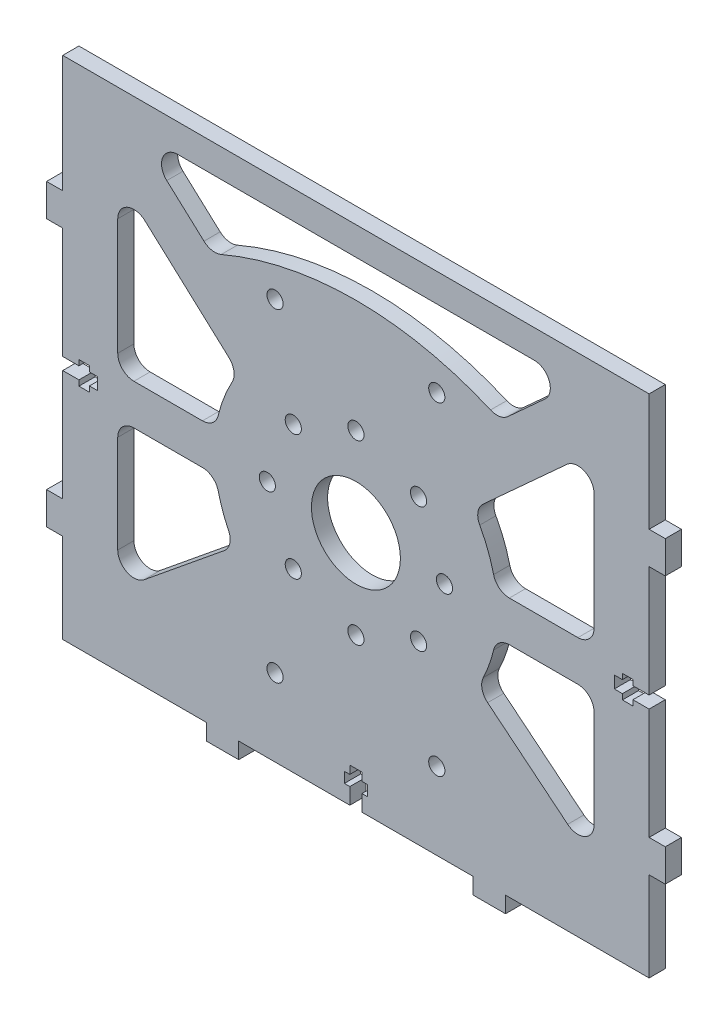
from build123d import *

# Parameters (mm, degrees)
SKETCH_1_R          = 2
SKETCH_1_R_2        = 11
EXTRUDE_1_DEPTH     = 4
CUT_EXTRUDE_2_DEPTH = 4


with BuildPart() as part:
    # 草图1 → 凸台-拉伸1 (new body)
    with BuildSketch(Plane.XY):
        Polygon((149, 64.5), (145, 64.5), (145, 37), (141, 37), (141, 29), (145, 29), (145, 6.9), (151.5, 6.9), (180.5, 6.9), (180.5, 2.9), (188.5, 2.9), (188.5, 6.9), (216, 6.9), (216, 10.9), (214.65, 10.9), (214.65, 13.5), (216, 13.5), (216, 15.5), (219, 15.5), (219, 13.5), (220.35, 13.5), (220.35, 10.9), (219, 10.9), (219, 6.9), (246.5, 6.9), (246.5, 2.9), (254.5, 2.9), (254.5, 6.9), (283.5, 6.9), (290, 6.9), (290, 29), (294, 29), (294, 37), (290, 37), (290, 64.5), (286, 64.5), (286, 63.15), (283.4, 63.15), (283.4, 64.5), (281.4, 64.5), (281.4, 67.5), (283.4, 67.5), (283.4, 68.85), (286, 68.85), (286, 67.5), (290, 67.5), (290, 95), (294, 95), (294, 103), (290, 103), (290, 132), (145, 132), (145, 103), (141, 103), (141, 95), (145, 95), (145, 67.5), (149, 67.5), (149, 68.85), (151.6, 68.85), (151.6, 67.5), (153.6, 67.5), (153.6, 64.5), (151.6, 64.5), (151.6, 63.15), (149, 63.15), align=None)
        with Locations((197.5, 26)):
            Circle(SKETCH_1_R, mode=Mode.SUBTRACT)
        with Locations((202.014361492, 50.514361492)):
            Circle(SKETCH_1_R, mode=Mode.SUBTRACT)
        with Locations((195.6, 66)):
            Circle(SKETCH_1_R, mode=Mode.SUBTRACT)
        with Locations((237.5, 26)):
            Circle(SKETCH_1_R, mode=Mode.SUBTRACT)
        with Locations((217.5, 44.1)):
            Circle(SKETCH_1_R, mode=Mode.SUBTRACT)
        with Locations((232.985638508, 50.514361492)):
            Circle(SKETCH_1_R, mode=Mode.SUBTRACT)
        with Locations((217.5, 66)):
            Circle(SKETCH_1_R_2, mode=Mode.SUBTRACT)
        with Locations((239.4, 66)):
            Circle(SKETCH_1_R, mode=Mode.SUBTRACT)
        with Locations((202.014361492, 81.485638508)):
            Circle(SKETCH_1_R, mode=Mode.SUBTRACT)
        with Locations((197.5, 106)):
            Circle(SKETCH_1_R, mode=Mode.SUBTRACT)
        with Locations((232.985638508, 81.485638508)):
            Circle(SKETCH_1_R, mode=Mode.SUBTRACT)
        with Locations((217.5, 87.9)):
            Circle(SKETCH_1_R, mode=Mode.SUBTRACT)
        with Locations((237.5, 106)):
            Circle(SKETCH_1_R, mode=Mode.SUBTRACT)
    extrude(amount=EXTRUDE_1_DEPTH)

    # 草图3 → 切除-拉伸2 (cut)
    with BuildSketch(Plane(origin=(0, 0, 0), x_dir=(-1, 0, 0), z_dir=(0, 0, -1))):
        with BuildLine():
            Line((-255.447331922, 61), (-272.4, 61))
            ThreePointArc((-272.4, 61), (-275.228427125, 59.828427125), (-276.4, 57))
            Line((-276.4, 57), (-276.4, 32.858450899))
            ThreePointArc((-276.4, 32.858450899), (-274.116182938, 29.24531983), (-269.872641938, 29.758053953))
            Line((-269.872641938, 29.758053953), (-250.07214558, 45.898872363))
            ThreePointArc((-250.07214558, 45.898872363), (-248.6940963, 48.134518776), (-248.999554551, 50.742933995))
            ThreePointArc((-248.999554551, 50.742933995), (-250.473448142, 54.263232234), (-251.555297879, 57.923076923))
            ThreePointArc((-251.555297879, 57.923076923), (-252.96663723, 60.137858162), (-255.447331922, 61))
        make_face()
        with BuildLine():
            Line((-269.707278747, 106.765103218), (-248.927132883, 87.848004914))
            ThreePointArc((-248.927132883, 87.848004914), (-247.673089718, 85.54051484), (-248.120381917, 82.952646144))
            ThreePointArc((-248.120381917, 82.952646144), (-250.140932956, 78.632082004), (-251.555297879, 74.076923077))
            ThreePointArc((-251.555297879, 74.076923077), (-252.96663723, 71.862141838), (-255.447331922, 71))
            Line((-255.447331922, 71), (-272.4, 71))
            ThreePointArc((-272.4, 71), (-275.228427125, 72.171572875), (-276.4, 75))
            Line((-276.4, 75), (-276.4, 103.807189721))
            ThreePointArc((-276.4, 103.807189721), (-274.016959336, 107.465801822), (-269.707278747, 106.765103218))
        make_face()
        with BuildLine():
            Line((-158.6, 57), (-158.6, 32.858450899))
            ThreePointArc((-158.6, 32.858450899), (-160.883817062, 29.24531983), (-165.127358062, 29.758053953))
            Line((-165.127358062, 29.758053953), (-184.92785442, 45.898872363))
            ThreePointArc((-184.92785442, 45.898872363), (-186.3059037, 48.134518776), (-186.000445449, 50.742933995))
            ThreePointArc((-186.000445449, 50.742933995), (-184.526551858, 54.263232234), (-183.444702121, 57.923076923))
            ThreePointArc((-183.444702121, 57.923076923), (-182.03336277, 60.137858162), (-179.552668078, 61))
            Line((-179.552668078, 61), (-162.6, 61))
            ThreePointArc((-162.6, 61), (-159.771572875, 59.828427125), (-158.6, 57))
        make_face()
        with BuildLine():
            Line((-179.552668078, 71), (-162.6, 71))
            ThreePointArc((-162.6, 71), (-159.771572875, 72.171572875), (-158.6, 75))
            Line((-158.6, 75), (-158.6, 103.807189721))
            ThreePointArc((-158.6, 103.807189721), (-160.983040664, 107.465801822), (-165.292721253, 106.765103218))
            Line((-165.292721253, 106.765103218), (-186.072867117, 87.848004914))
            ThreePointArc((-186.072867117, 87.848004914), (-187.326910282, 85.54051484), (-186.879618083, 82.952646144))
            ThreePointArc((-186.879618083, 82.952646144), (-184.859067044, 78.632082004), (-183.444702121, 74.076923077))
            ThreePointArc((-183.444702121, 74.076923077), (-182.03336277, 71.862141838), (-179.552668078, 71))
        make_face()
        with BuildLine():
            Line((-261.576319533, 125), (-173.423680467, 125))
            ThreePointArc((-173.423680467, 125), (-169.693288129, 122.443666515), (-170.730959214, 118.042086503))
            Line((-170.730959214, 118.042086503), (-179.92985273, 109.667921372))
            ThreePointArc((-179.92985273, 109.667921372), (-181.961826365, 108.680785745), (-184.204551796, 108.951961409))
            ThreePointArc((-184.204551796, 108.951961409), (-217.5, 115.815856239), (-250.795448204, 108.951961409))
            ThreePointArc((-250.795448204, 108.951961409), (-253.038173635, 108.680785745), (-255.07014727, 109.667921372))
            Line((-255.07014727, 109.667921372), (-264.269040786, 118.042086503))
            ThreePointArc((-264.269040786, 118.042086503), (-265.306711871, 122.443666515), (-261.576319533, 125))
        make_face()
    extrude(amount=-CUT_EXTRUDE_2_DEPTH, mode=Mode.SUBTRACT)


solid = part.part
